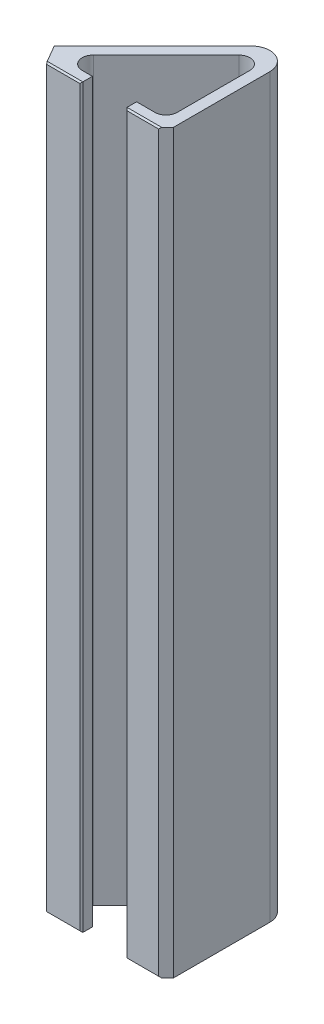
from build123d import *

# Parameters (mm, degrees)
EXTRUDE_1_DEPTH = 200
FILLET_1_R      = 3
FILLET_2_R      = 5
CHAMFER_1_SIZE  = 7
CHAMFER_1_SIZE2 = 7.807485502
CHAMFER_2_SIZE  = 2
CHAMFER_3_SIZE  = 0.4


with BuildPart() as part:
    # 草图1 → 凸台-拉伸1 (new body)
    with BuildSketch(Plane(origin=(0, 0, 0), x_dir=(1, 0, 0), z_dir=(0, 1, 0))):
        Polygon((0, 0), (0, 30), (-30, 0), (-20, 0), (-20, -3), (-37.242640687, -3), (3, 37.242640687), (3, -3), (-8, -3), (-8, 0), align=None)
    extrude(amount=EXTRUDE_1_DEPTH)

    # 圆角1
    fillet_1_edges = [part.edges().sort_by_distance(p)[0] for p in [
        (0, 100, 0),
        (0, 100, -30),
        (-30, 100, 0),
    ]]
    fillet(fillet_1_edges, radius=FILLET_1_R)

    # 圆角2
    fillet_2_edges = [part.edges().sort_by_distance(p)[0] for p in [
        (3, 100, -37.242640687),
    ]]
    fillet(fillet_2_edges, radius=FILLET_2_R)

    # 倒角1
    chamfer_1_edges = [part.edges().sort_by_distance(p)[0] for p in [
        (-37.242640687, 100, 3),
    ]]
    chamfer_1_side = [part.faces().sort_by_distance(p)[0] for p in [
        (-21.389087297, 100, -12.853553391),
    ]]
    chamfer(chamfer_1_edges, length=CHAMFER_1_SIZE, length2=CHAMFER_1_SIZE2, reference=chamfer_1_side[0])

    # 倒角2
    chamfer_2_edges = [part.edges().sort_by_distance(p)[0] for p in [
        (3, 100, 3),
    ]]
    chamfer(chamfer_2_edges, length=CHAMFER_2_SIZE)

    # 倒角3
    chamfer_3_edges = [part.edges().sort_by_distance(p)[0] for p in [
        (-3.5, 200, 3),
        (-3.5, 0, 3),
        (-20, 100, 3),
        (-8, 100, 3),
        (-24.717577593, 0, 3),
        (-24.717577593, 200, 3),
    ]]
    chamfer(chamfer_3_edges, length=CHAMFER_3_SIZE)


solid = part.part
